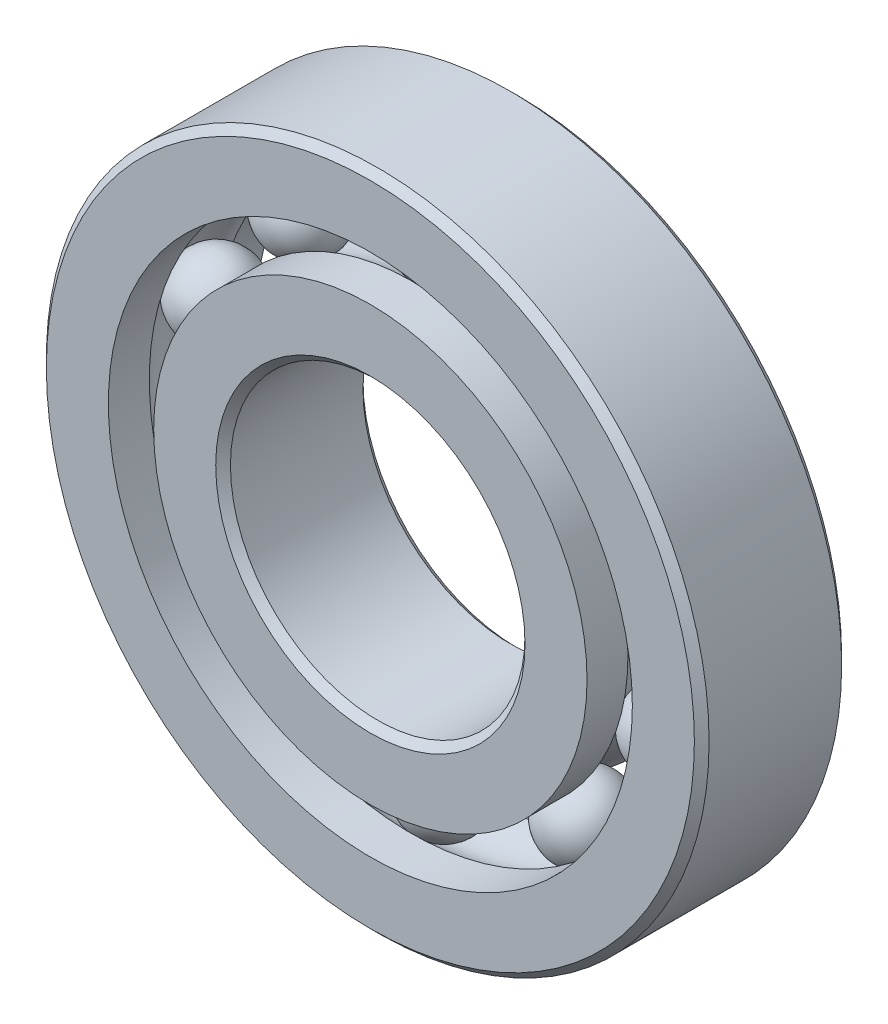
from build123d import *

# Parameters (mm, degrees)
CIRPATTERN1_COUNT = 10


with BuildPart() as part:
    # Sketch1 → Revolve1 (revolve)
    with BuildSketch(Plane(origin=(0, 0, 0), x_dir=(0, 0, -1), z_dir=(1, 0, 0)), mode=Mode.PRIVATE) as revolve1_sk:
        with BuildLine():
            Line((2.8575, 14.2875), (-2.8575, 14.2875))
            Line((-2.8575, 14.2875), (-3.175, 13.97))
            Line((-3.175, 13.97), (-3.175, 11.295673077))
            Line((-3.175, 11.295673077), (-1.411111111, 11.295673077))
            ThreePointArc((-1.411111111, 11.295673077), (0, 12.035028901), (1.411111111, 11.295673077))
            Line((1.411111111, 11.295673077), (3.175, 11.295673077))
            Line((3.175, 11.295673077), (3.175, 13.97))
            Line((3.175, 13.97), (2.8575, 14.2875))
        make_face()
    revolve(revolve1_sk.sketch.rotate(Axis((0, 0, 3.175), (0, 0, -1)), 90), axis=Axis((0, 0, 3.175), (0, 0, -1)))


with BuildPart() as body_2:
    # Sketch3 → Revolve3 (revolve)
    with BuildSketch(Plane(origin=(0, 0, 0), x_dir=(0, 0, -1), z_dir=(1, 0, 0)), mode=Mode.PRIVATE) as revolve3_sk:
        with BuildLine():
            Line((-3.175, 9.341826923), (-1.411111111, 9.341826923))
            ThreePointArc((-1.411111111, 9.341826923), (0, 8.602471099), (1.411111111, 9.341826923))
            Line((1.411111111, 9.341826923), (3.175, 9.341826923))
            Line((3.175, 9.341826923), (3.175, 6.6675))
            Line((3.175, 6.6675), (2.8575, 6.35))
            Line((2.8575, 6.35), (-2.8575, 6.35))
            Line((-2.8575, 6.35), (-3.175, 6.6675))
            Line((-3.175, 6.6675), (-3.175, 9.341826923))
        make_face()
    revolve(revolve3_sk.sketch.rotate(Axis((0, 0, 3.175), (0, 0, -1)), 90), axis=Axis((0, 0, 3.175), (0, 0, -1)))


with BuildPart() as body_3:
    # Sketch4 → Revolve4 (revolve)
    with BuildSketch(Plane(origin=(0, 0, 0), x_dir=(0, 0, -1), z_dir=(1, 0, 0))):
        with BuildLine():
            Line((-1.716278901, 10.31875), (1.716278901, 10.31875))
            ThreePointArc((1.716278901, 10.31875), (0, 12.035028901), (-1.716278901, 10.31875))
        make_face()
    revolve(axis=Axis((0, 10.31875, 1.716278901), (0, 0, -1)))


with BuildPart() as cirpattern1_1:
    # CirPattern1: pattern copy
    add(body_3.part.rotate(Axis((0, 0, 0), (0, 0, 1)), 1 * 360 / CIRPATTERN1_COUNT))


with BuildPart() as cirpattern1_2:
    # CirPattern1: pattern copy
    add(body_3.part.rotate(Axis((0, 0, 0), (0, 0, 1)), 2 * 360 / CIRPATTERN1_COUNT))


with BuildPart() as cirpattern1_3:
    # CirPattern1: pattern copy
    add(body_3.part.rotate(Axis((0, 0, 0), (0, 0, 1)), 3 * 360 / CIRPATTERN1_COUNT))


with BuildPart() as cirpattern1_4:
    # CirPattern1: pattern copy
    add(body_3.part.rotate(Axis((0, 0, 0), (0, 0, 1)), 4 * 360 / CIRPATTERN1_COUNT))


with BuildPart() as cirpattern1_5:
    # CirPattern1: pattern copy
    add(body_3.part.rotate(Axis((0, 0, 0), (0, 0, 1)), 5 * 360 / CIRPATTERN1_COUNT))


with BuildPart() as cirpattern1_6:
    # CirPattern1: pattern copy
    add(body_3.part.rotate(Axis((0, 0, 0), (0, 0, 1)), 6 * 360 / CIRPATTERN1_COUNT))


with BuildPart() as cirpattern1_7:
    # CirPattern1: pattern copy
    add(body_3.part.rotate(Axis((0, 0, 0), (0, 0, 1)), 7 * 360 / CIRPATTERN1_COUNT))


with BuildPart() as cirpattern1_8:
    # CirPattern1: pattern copy
    add(body_3.part.rotate(Axis((0, 0, 0), (0, 0, 1)), 8 * 360 / CIRPATTERN1_COUNT))


with BuildPart() as cirpattern1_9:
    # CirPattern1: pattern copy
    add(body_3.part.rotate(Axis((0, 0, 0), (0, 0, 1)), 9 * 360 / CIRPATTERN1_COUNT))


solid = Compound([part.part, body_2.part, body_3.part, cirpattern1_1.part, cirpattern1_2.part, cirpattern1_3.part, cirpattern1_4.part, cirpattern1_5.part, cirpattern1_6.part, cirpattern1_7.part, cirpattern1_8.part, cirpattern1_9.part])
